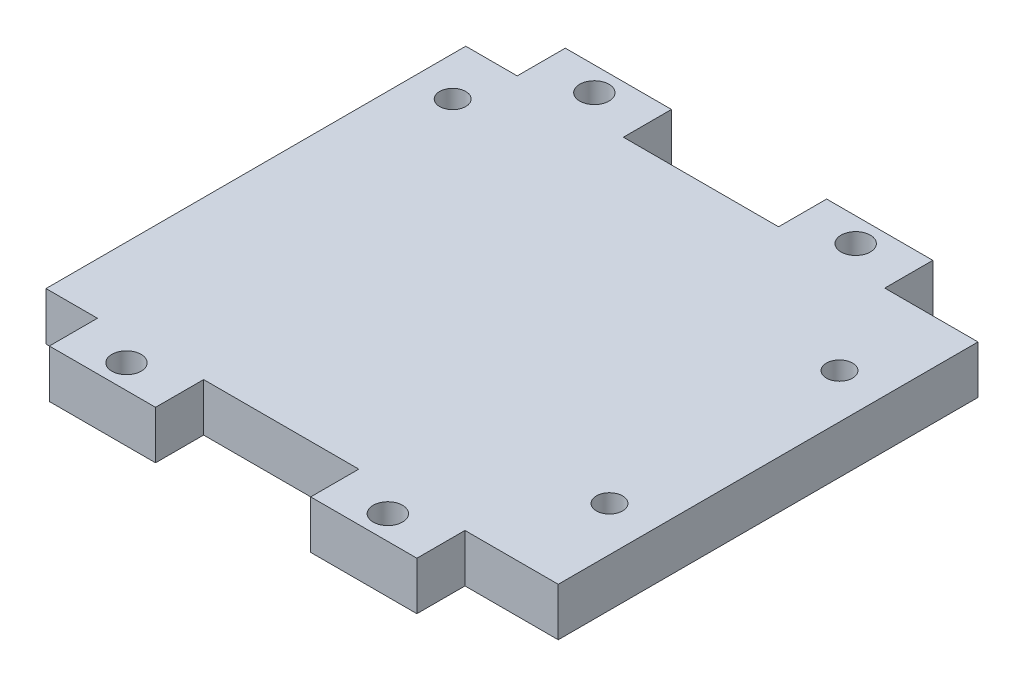
from build123d import *

# Parameters (mm, degrees)
BOSS_EXTRUDE1_DEPTH = 5.842
SKETCH2_R           = 1.778
CUT_EXTRUDE1_DEPTH  = 43.811518376
SKETCH3_W           = 5.08
SKETCH3_H           = 50.995072
BOSS_EXTRUDE2_DEPTH = 5.842
SKETCH4_R           = 1.5875
CUT_EXTRUDE2_DEPTH  = 47.356817252


with BuildPart() as part:
    # Sketch1 → Boss-Extrude1 (new body)
    with BuildSketch(Plane(origin=(0, 0, 0), x_dir=(1, 0, 0), z_dir=(0, 1, 0))):
        Polygon((22.325, -31.339536), (9.425, -31.339536), (9.425, -25.497536), (-9.425, -25.497536), (-9.425, -31.339536), (-22.325, -31.339536), (-22.325, -25.497536), (-28.575, -25.497536), (-28.575, 25.497536), (-22.325, 25.497536), (-22.325, 31.339536), (-9.425, 31.339536), (-9.425, 25.497536), (9.425, 25.497536), (9.425, 31.339536), (22.325, 31.339536), (22.325, 25.497536), (28.575, 25.497536), (28.575, -25.497536), (22.325, -25.497536), align=None)
    extrude(amount=BOSS_EXTRUDE1_DEPTH)

    # Sketch2 → Cut-Extrude1 (cut, through all)
    with BuildSketch(Plane(origin=(0, 5.842, 0), x_dir=(1, 0, 0), z_dir=(0, 1, 0))):
        with Locations(Location((-15.875, 28.418536, 0), (0, 0, 270))):
            Circle(SKETCH2_R)
        with Locations(Location((-15.875, -28.418536, 0), (0, 0, 270))):
            Circle(SKETCH2_R)
        with Locations(Location((15.875, 28.418536, 0), (0, 0, 90))):
            Circle(SKETCH2_R)
        with Locations(Location((15.875, -28.418536, 0), (0, 0, 90))):
            Circle(SKETCH2_R)
    extrude(amount=-CUT_EXTRUDE1_DEPTH, mode=Mode.SUBTRACT)

    # Sketch3 → Boss-Extrude2 (add)
    with BuildSketch(Plane(origin=(0, 5.842, 0), x_dir=(1, 0, 0), z_dir=(0, 1, 0))):
        with Locations((31.115, 0)):
            Rectangle(SKETCH3_W, SKETCH3_H)
    extrude(amount=-BOSS_EXTRUDE2_DEPTH)

    # Sketch4 → Cut-Extrude2 (cut, through all)
    with BuildSketch(Plane(origin=(0, 0, 0), x_dir=(-1, 0, 0), z_dir=(0, -1, 0))):
        with Locations(Location((23.8125, 19.147536, 0), (0, 0, 90))):
            Circle(SKETCH4_R)
        with Locations(Location((-28.2575, 14.067536, 0), (0, 0, 90))):
            Circle(SKETCH4_R)
        with Locations(Location((-28.2575, -13.872464, 0), (0, 0, 90))):
            Circle(SKETCH4_R)
    extrude(amount=-CUT_EXTRUDE2_DEPTH, mode=Mode.SUBTRACT)


solid = part.part
